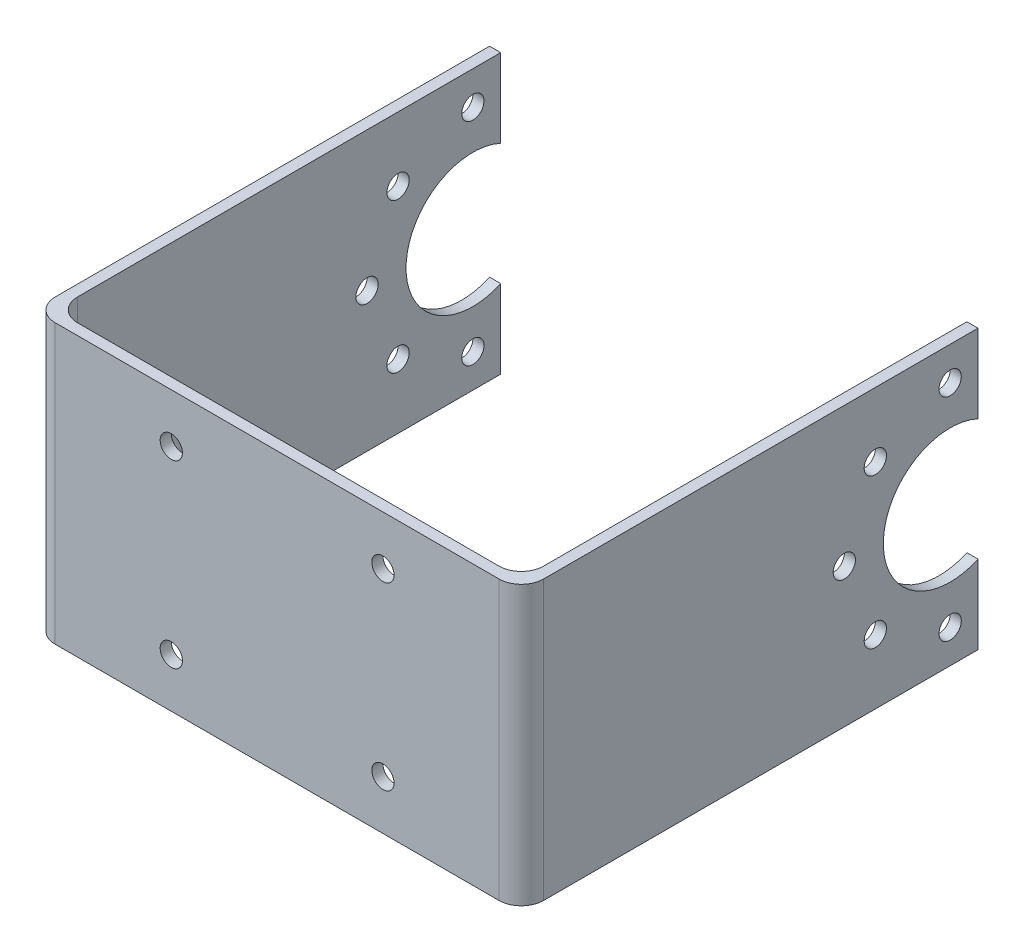
from build123d import *

# Parameters (mm, degrees)
BOSS_EXTRUDE1_DEPTH = 25
SKETCH2_R           = 1
SKETCH2_R_2         = 6
CUT_EXTRUDE1_DEPTH  = 65.715318897
FILLET2_R           = 2
SKETCH3_R           = 1
CUT_EXTRUDE2_DEPTH  = 54.030651514


with BuildPart() as part:
    # Sketch1 → Boss-Extrude1 (new body)
    with BuildSketch(Plane(origin=(0, 0, 0), x_dir=(1, 0, 0), z_dir=(0, 1, 0))):
        Polygon((-21.5, 0.5), (20.35, 0.5), (20.35, 40.5), (21.35, 40.5), (21.35, 0.5), (21.35, -0.5), (-22.5, -0.5), (-22.5, 0.5), (-22.5, 40.5), (-21.5, 40.5), align=None)
    extrude(amount=BOSS_EXTRUDE1_DEPTH)

    # Sketch2 → Cut-Extrude1 (cut, through all)
    with BuildSketch(Plane(origin=(21.35, 0, 0), x_dir=(0, 0, -1), z_dir=(1, 0, 0))):
        with Locations((28.5, 12.5)):
            Circle(SKETCH2_R)
        with Locations((38, 12.5)):
            Circle(SKETCH2_R_2)
        with Locations((31.282485579, 19.217514421)):
            Circle(SKETCH2_R)
        with Locations((38, 22)):
            Circle(SKETCH2_R)
        with Locations((38, 3)):
            Circle(SKETCH2_R)
        with Locations((31.282485579, 5.782485579)):
            Circle(SKETCH2_R)
    extrude(amount=-CUT_EXTRUDE1_DEPTH, mode=Mode.SUBTRACT)

    # Fillet2
    fillet2_edges = [part.edges().sort_by_distance(p)[0] for p in [
        (21.35, 12.5, 0.5),
        (-22.5, 12.5, 0.5),
        (-21.5, 12.5, -0.5),
        (20.35, 12.5, -0.5),
    ]]
    fillet(fillet2_edges, radius=FILLET2_R)

    # Sketch3 → Cut-Extrude2 (cut, through all)
    with BuildSketch(Plane.XY.offset(0.5)):
        with Locations((-10.075, 20.585)):
            Circle(SKETCH3_R)
        with Locations((8.925, 20.585)):
            Circle(SKETCH3_R)
        with Locations((-10.075, 4.415)):
            Circle(SKETCH3_R)
        with Locations((8.925, 4.415)):
            Circle(SKETCH3_R)
    extrude(amount=-CUT_EXTRUDE2_DEPTH, mode=Mode.SUBTRACT)


solid = part.part
